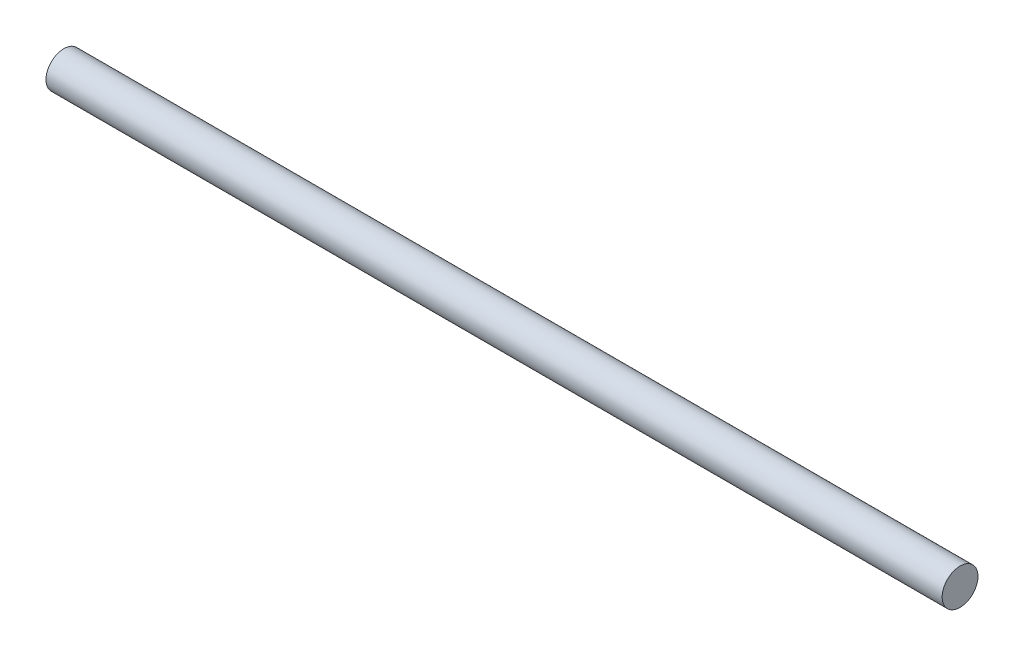
from build123d import *

# Parameters (mm, degrees)
SKETCH_1_R      = 4
EXTRUDE_1_DEPTH = 200


with BuildPart() as part:
    # 草图1 → 凸台-拉伸1 (new body)
    with BuildSketch(Plane(origin=(0, 0, 0), x_dir=(0, 0, -1), z_dir=(1, 0, 0))):
        Circle(SKETCH_1_R)
    extrude(amount=EXTRUDE_1_DEPTH)


solid = part.part
